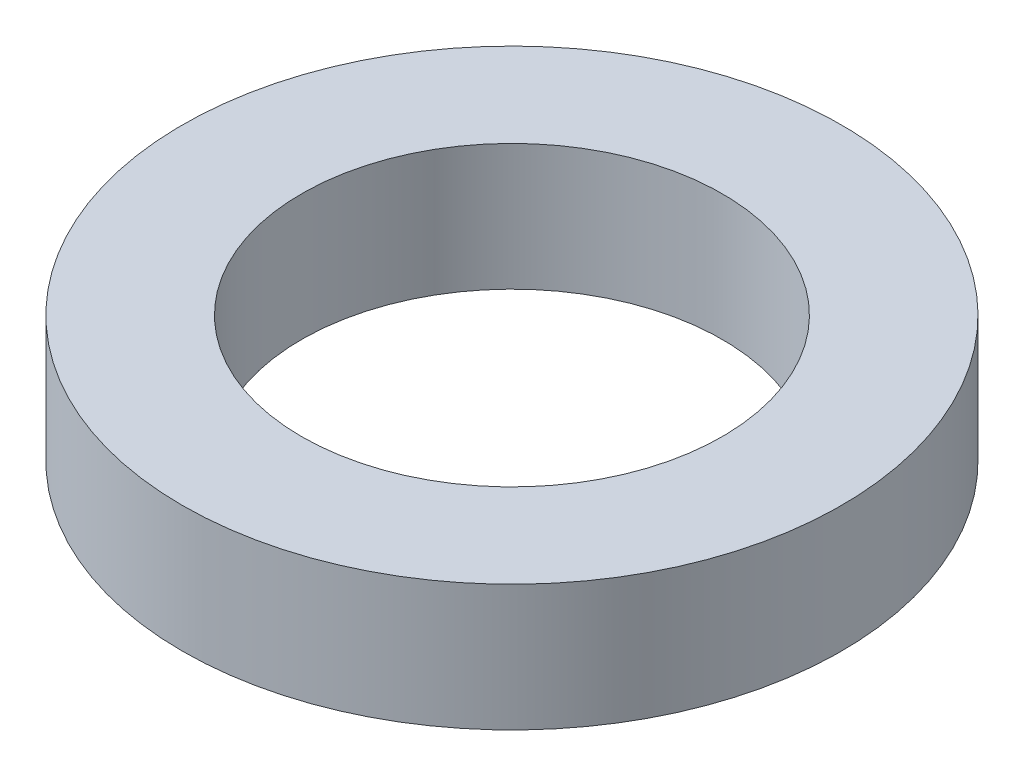
from build123d import *

# Parameters (mm, degrees)
SKETCH_1_R      = 23.5
SKETCH_1_R_2    = 15
EXTRUDE_1_DEPTH = 9


with BuildPart() as part:
    # 草图1 → 凸台-拉伸1 (new body)
    with BuildSketch(Plane(origin=(0, 0, 0), x_dir=(1, 0, 0), z_dir=(0, 1, 0))):
        with Locations(Location((0, 0, 0), (0, 0, 270))):
            Circle(SKETCH_1_R)
        with Locations(Location((0, 0, 0), (0, 0, 270))):
            Circle(SKETCH_1_R_2, mode=Mode.SUBTRACT)
    extrude(amount=EXTRUDE_1_DEPTH)


solid = part.part
